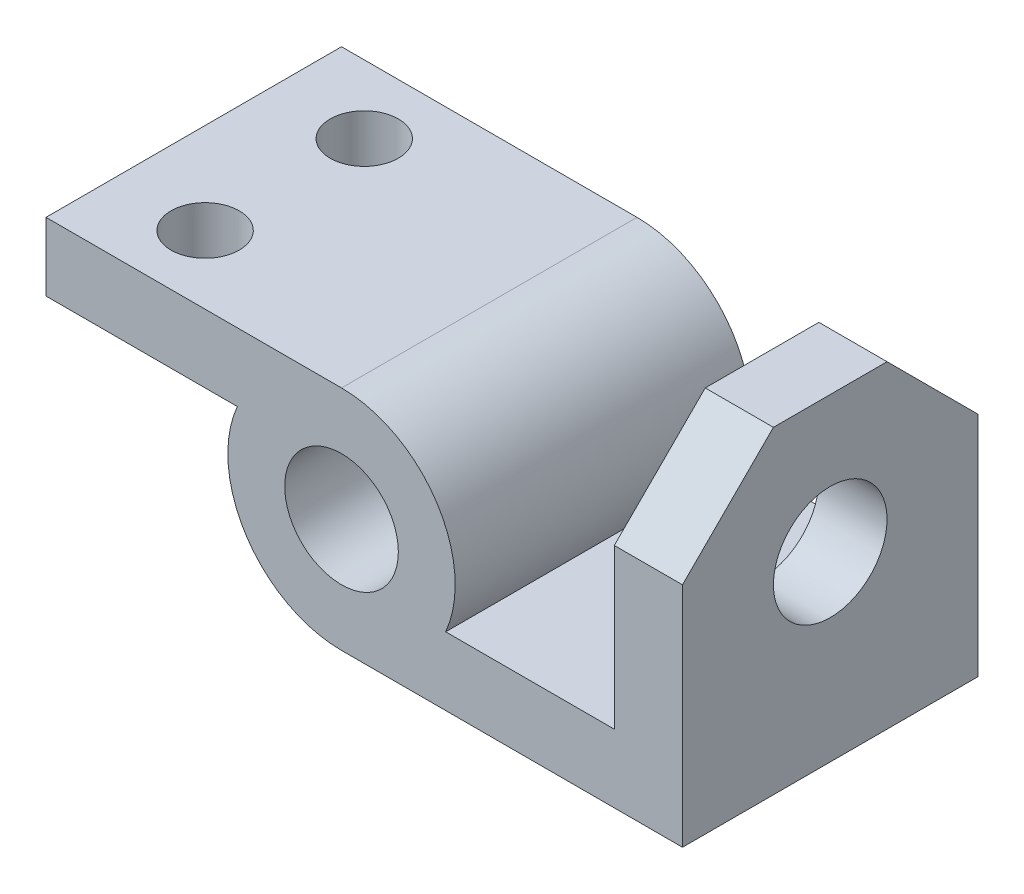
from build123d import *

# Parameters (mm, degrees)
BOSS_EXTRUDE1_DEPTH = 41.275
SKETCH2_R           = 9.525
CUT_EXTRUDE1_DEPTH  = 122.689926144
CUT_EXTRUDE2_REACH  = 193.266
SKETCH3_R           = 15.875
CHAMFER1_SIZE       = 25.4
SKETCH4_R           = 15.875
CUT_EXTRUDE3_DEPTH  = 82.55


with BuildPart() as part:
    # Sketch1 → Boss-Extrude1 (new, symmetric)
    with BuildSketch(Plane.XY):
        with BuildLine():
            Line((0, 31.75), (-82.55, 31.75))
            Line((-82.55, 31.75), (-82.55, 12.7))
            Line((-82.55, 12.7), (-29.099355663, 12.7))
            ThreePointArc((-29.099355663, 12.7), (-26.563955842, -17.390191201), (0, -31.75))
            Line((0, -31.75), (95.25, -31.75))
            Line((95.25, -31.75), (95.25, 57.15))
            Line((95.25, 57.15), (76.2, 57.15))
            Line((76.2, 57.15), (76.2, -12.7))
            Line((76.2, -12.7), (29.099355663, -12.7))
            ThreePointArc((29.099355663, -12.7), (26.563955842, 17.390191201), (0, 31.75))
        make_face()
    extrude(amount=BOSS_EXTRUDE1_DEPTH, both=True)

    # Sketch2 → Cut-Extrude1 (cut, through all)
    with BuildSketch(Plane(origin=(0, 31.75, 0), x_dir=(1, 0, 0), z_dir=(0, 1, 0))):
        with Locations(Location((-57.15, 22.225, 0), (0, 0, 180))):
            Circle(SKETCH2_R)
        with Locations(Location((-57.15, -22.225, 0), (0, 0, 270))):
            Circle(SKETCH2_R)
    extrude(amount=-CUT_EXTRUDE1_DEPTH, mode=Mode.SUBTRACT)

    # Sketch3 → Cut-Extrude2 (cut, up to next)
    with BuildSketch(Plane(origin=(95.25, 0, 0), x_dir=(0, 0, -1), z_dir=(1, 0, 0)), mode=Mode.PRIVATE) as cut_extrude2_sk1:
        with Locations((0, 19.05)):
            Circle(SKETCH3_R)
    cut_extrude2_tool1 = extrude(cut_extrude2_sk1.sketch, amount=-CUT_EXTRUDE2_REACH, mode=Mode.PRIVATE) & part.part
    add(cut_extrude2_tool1.solids().sort_by_distance((95.25, 19.05, 0))[0], mode=Mode.SUBTRACT)

    # Chamfer1
    chamfer1_edges = [part.edges().sort_by_distance(p)[0] for p in [
        (85.725, 57.15, -41.275),
        (85.725, 57.15, 41.275),
    ]]
    chamfer(chamfer1_edges, length=CHAMFER1_SIZE)

    # Sketch4 → Cut-Extrude3 (cut)
    with BuildSketch(Plane.XY.offset(41.275)):
        Circle(SKETCH4_R)
    extrude(amount=-CUT_EXTRUDE3_DEPTH, mode=Mode.SUBTRACT)


solid = part.part
